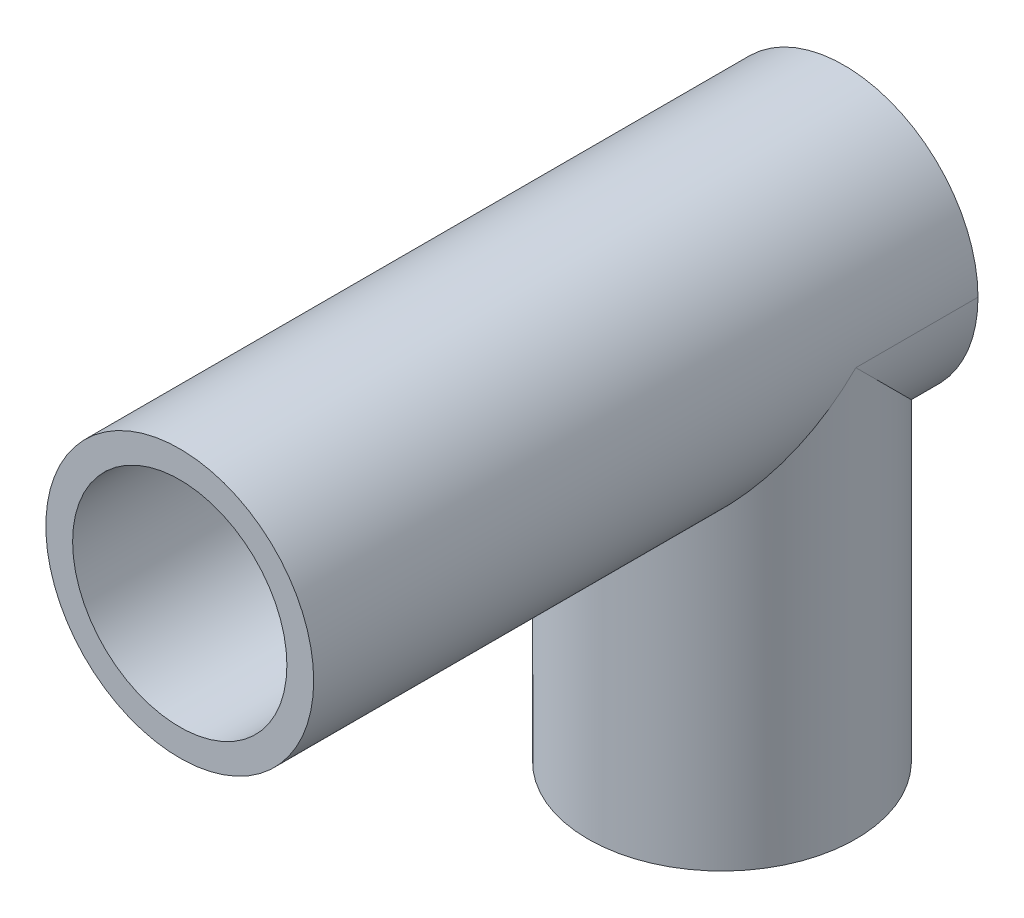
from build123d import *

# Parameters (mm, degrees)
SKETCH1_R                = 25
SKETCH1_R_2              = 20
BOSS_EXTRUDE1_DEPTH      = 76.2
BOSS_EXTRUDE2_DEPTH      = 76.2
BOSS_EXTRUDE2_DEPTH_BACK = 50
SKETCH2_R                = 25
SKETCH2_R_2              = 20
SKETCH3_R                = 20
CUT_EXTRUDE1_DEPTH       = 145.2
CUT_EXTRUDE2_START       = -2.2
SKETCH4_R                = 25
CUT_EXTRUDE2_DEPTH       = 2.2
BOSS_EXTRUDE3_START      = -2.54
SKETCH5_R                = 20
BOSS_EXTRUDE3_DEPTH      = 2.54


with BuildPart() as part:
    # Sketch1 → Boss-Extrude1 (new body)
    with BuildSketch(Plane(origin=(0, 0, 0), x_dir=(1, 0, 0), z_dir=(0, 1, 0))):
        with Locations(Location((0, 0, 0), (0, 0, 90))):
            Circle(SKETCH1_R)
        with Locations(Location((0, 0, 0), (0, 0, 90))):
            Circle(SKETCH1_R_2, mode=Mode.SUBTRACT)
    extrude(amount=BOSS_EXTRUDE1_DEPTH)

    # Sketch2 → Boss-Extrude2 (add, two sides: drawn at the far end of the back side and taken through both)
    with BuildSketch(Plane.XY.offset(25).offset(-BOSS_EXTRUDE2_DEPTH_BACK)):
        with Locations((0, 76.2)):
            Circle(SKETCH2_R)
        with Locations((0, 76.2)):
            Circle(SKETCH2_R_2, mode=Mode.SUBTRACT)
    extrude(amount=BOSS_EXTRUDE2_DEPTH + BOSS_EXTRUDE2_DEPTH_BACK)

    # Sketch3 → Cut-Extrude1 (cut)
    with BuildSketch(Plane.XY.offset(101.2)):
        with Locations((0, 76.2)):
            Circle(SKETCH3_R)
    extrude(amount=-CUT_EXTRUDE1_DEPTH, mode=Mode.SUBTRACT)

    # Sketch4 → Cut-Extrude2 (cut)
    with BuildSketch(Plane(origin=(0, 0, -25), x_dir=(-1, 0, 0), z_dir=(0, 0, -1)).offset(CUT_EXTRUDE2_START)):
        with Locations(Location((0, 76.2, 0), (0, 0, 180))):
            Circle(SKETCH4_R)
    extrude(amount=CUT_EXTRUDE2_DEPTH, mode=Mode.SUBTRACT)

    # Sketch5 → Boss-Extrude3 (add)
    with BuildSketch(Plane(origin=(0, 0, -22.8), x_dir=(-1, 0, 0), z_dir=(0, 0, -1)).offset(BOSS_EXTRUDE3_START)):
        with Locations(Location((0, 76.2, 0), (0, 0, 180))):
            Circle(SKETCH5_R)
    extrude(amount=BOSS_EXTRUDE3_DEPTH)


solid = part.part
